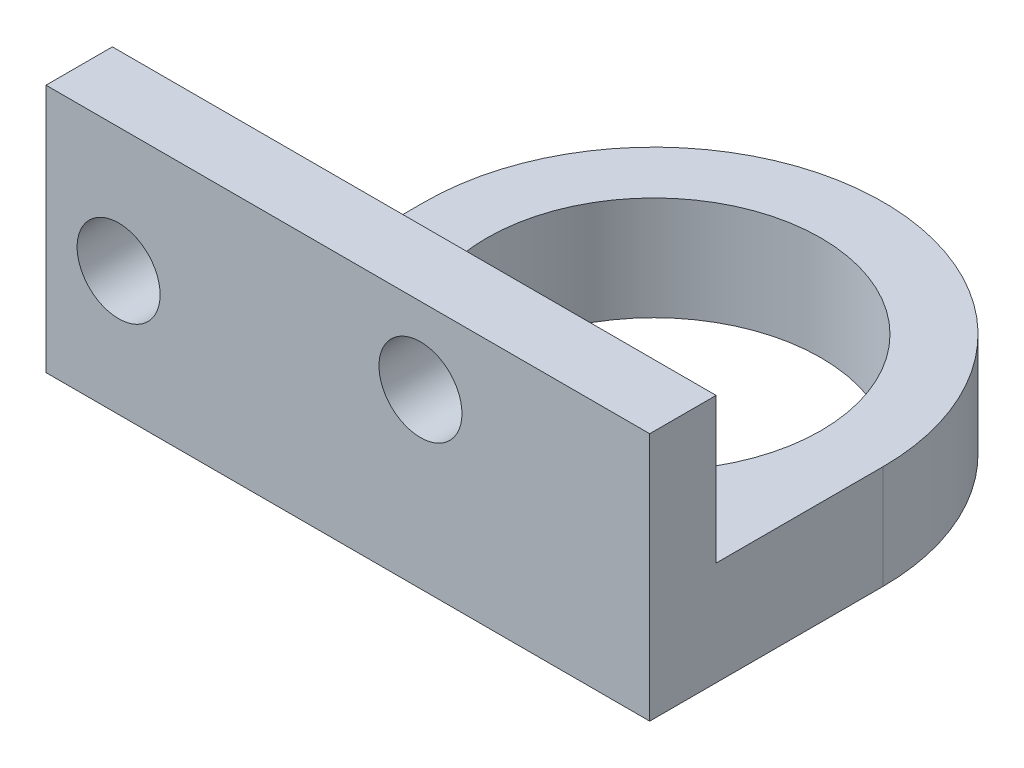
from build123d import *
from build123d.topology import SkipClean

# Parameters (mm, degrees)
SKETCH1_R           = 8.05
BOSS_EXTRUDE1_DEPTH = 5
BOSS_EXTRUDE2_DEPTH = 3
BOSS_EXTRUDE3_START = 0.2
SKETCH4_W           = 29.1
SKETCH4_H           = 12
SKETCH4_R           = 2
BOSS_EXTRUDE3_DEPTH = 0.2


with BuildPart() as part:
    # Sketch1 → Boss-Extrude1 (new body)
    with BuildSketch(Plane(origin=(0, 0, 0), x_dir=(1, 0, 0), z_dir=(0, 1, 0))):
        with BuildLine():
            Line((11.05, 0), (11.05, -11.05))
            Line((11.05, -11.05), (0, -11.05))
            Line((0, -11.05), (-11.05, -11.05))
            Line((-11.05, -11.05), (-11.05, 0))
            ThreePointArc((-11.05, 0), (0, 11.05), (11.05, 0))
        make_face()
        with Locations(Location((0, 0, 0), (0, 0, 270))):
            Circle(SKETCH1_R, mode=Mode.SUBTRACT)
    extrude(amount=BOSS_EXTRUDE1_DEPTH)

    # Sketch2 → Boss-Extrude2 (add)
    with BuildSketch(Plane.XY.offset(11.05)):
        with BuildLine():
            Line((-11.05, 0), (-11.05, 5))
            Line((-11.05, 5), (-11.05, 6))
            Line((-11.05, 6), (-12.55, 6))
            ThreePointArc((-12.55, 6), (-14.55, 4), (-16.55, 6))
            Line((-16.55, 6), (-18.05, 6))
            Line((-18.05, 6), (-18.05, 0))
            Line((-18.05, 0), (-11.05, 0))
        make_face()
        with BuildLine():
            Line((-12.55, 6), (-11.05, 6))
            Line((-11.05, 6), (-11.05, 12))
            Line((-11.05, 12), (-18.05, 12))
            Line((-18.05, 12), (-18.05, 6))
            Line((-18.05, 6), (-16.55, 6))
            ThreePointArc((-16.55, 6), (-14.55, 8), (-12.55, 6))
        make_face()
        with BuildLine():
            Line((-11.05, 5), (0, 5))
            Line((0, 5), (0, 6.313879641))
            ThreePointArc((0, 6.313879641), (-2, 8.313879641), (0, 10.313879641))
            Line((0, 10.313879641), (0, 12))
            Line((0, 12), (-11.05, 12))
            Line((-11.05, 12), (-11.05, 6))
            Line((-11.05, 6), (-11.05, 5))
        make_face()
        with BuildLine():
            Line((0, 6.313879641), (0, 5))
            Line((0, 5), (11.05, 5))
            Line((11.05, 5), (11.05, 12))
            Line((11.05, 12), (0, 12))
            Line((0, 12), (0, 10.313879641))
            ThreePointArc((0, 10.313879641), (1.414213562, 9.728093204), (2, 8.313879641))
            ThreePointArc((2, 8.313879641), (1.414213562, 6.899666079), (0, 6.313879641))
        make_face()
    extrude(amount=-BOSS_EXTRUDE2_DEPTH)

    # Sketch4 → Boss-Extrude3 (add)
    with SkipClean():  # the faces are left unmerged after this step: merging them gives an invalid solid
        with BuildSketch(Plane.XY.offset(11.05).offset(BOSS_EXTRUDE3_START)):
            with Locations((-3.5, 6)):
                Rectangle(SKETCH4_W, SKETCH4_H)
            with Locations((0, 8.313879641)):
                Circle(SKETCH4_R, mode=Mode.SUBTRACT)
            with Locations((-14.55, 6)):
                Circle(SKETCH4_R, mode=Mode.SUBTRACT)
        extrude(amount=-BOSS_EXTRUDE3_DEPTH)


solid = part.part
